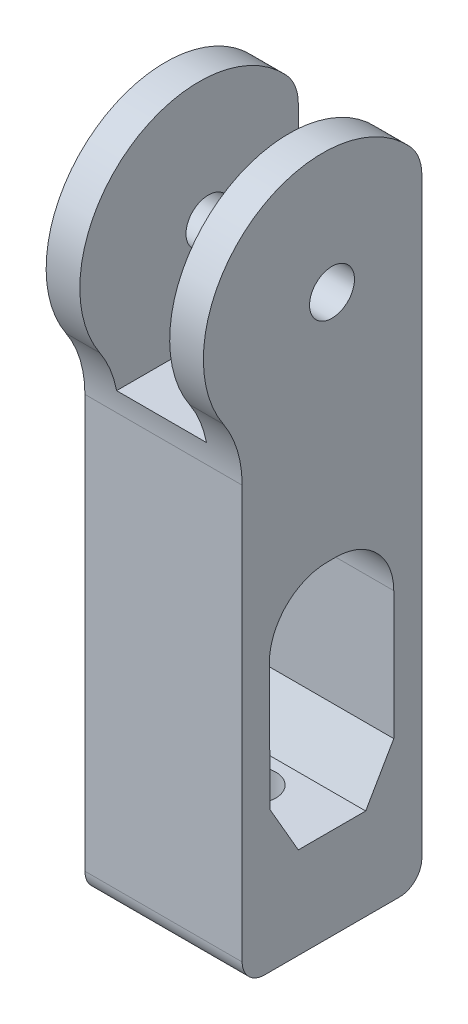
from build123d import *
from OCP.BRepFilletAPI import BRepFilletAPI_MakeChamfer

# Parameters (mm, degrees)
SKETCH9_R           = 2
BOSS_EXTRUDE3_DEPTH = 14
SKETCH10_R          = 2
CUT_EXTRUDE7_DEPTH  = 14
SKETCH11_W          = 8
SKETCH11_H          = 26.663957413
CUT_EXTRUDE8_DEPTH  = 25
FILLET1_R           = 2
CHAMFER1_SIZE       = 2.5
CHAMFER1_SIZE2      = 4.365846821
CHAMFER1_SIZE2_2    = 4.330127019


with BuildPart() as part:
    # Sketch9 → Boss-Extrude3 (new body)
    with BuildSketch(Plane(origin=(0, 0, 0), x_dir=(0, 0, -1), z_dir=(1, 0, 0))):
        with BuildLine():
            Line((8, 5.053889445), (8, -49.642014822))
            Line((8, -49.642014822), (-8, -49.642014822))
            Line((-8, -49.642014822), (-8, -10.875806049))
            ThreePointArc((-8, -10.875806049), (-8.427714838, -7.982476346), (-9.674271354, -5.336650652))
            ThreePointArc((-9.674271354, -5.336650652), (-7.418447874, 8.870328147), (6.925281884, 7.78202542))
            ThreePointArc((6.925281884, 7.78202542), (7.721634556, 6.519985019), (8, 5.053889445))
        make_face()
        Circle(SKETCH9_R, mode=Mode.SUBTRACT)
        with BuildLine():
            Line((5.5, -41.5), (5.5, -25.762364524))
            ThreePointArc((5.5, -25.762364524), (3.987567872, -22.111030369), (0.336233717, -20.598598241))
            Line((0.336233717, -20.598598241), (-0.410415455, -20.598598241))
            ThreePointArc((-0.410415455, -20.598598241), (-4.070351606, -22.119652678), (-5.574124284, -25.786723302))
            Line((-5.574124284, -25.786723302), (-5.5, -41.5))
            Line((-5.5, -41.5), (5.5, -41.5))
        make_face(mode=Mode.SUBTRACT)
    extrude(amount=BOSS_EXTRUDE3_DEPTH)

    # Sketch10 → Cut-Extrude7 (cut)
    with BuildSketch(Plane.XZ.offset(49.642014822)):
        with Locations(Location((7, 0, 0), (0, 0, 270))):
            Circle(SKETCH10_R)
    extrude(amount=-CUT_EXTRUDE7_DEPTH, mode=Mode.SUBTRACT)

    # Sketch11 → Cut-Extrude8 (cut)
    with BuildSketch(Plane(origin=(0, 16, 0), x_dir=(1, 0, 0), z_dir=(0, 1, 0))):
        with Locations((7, -2.726740944)):
            Rectangle(SKETCH11_W, SKETCH11_H)
    extrude(amount=-CUT_EXTRUDE8_DEPTH, mode=Mode.SUBTRACT)

    # Fillet1
    fillet1_edges = [part.edges().sort_by_distance(p)[0] for p in [
        (7, -49.642014822, 8),
        (7, -49.642014822, -8),
    ]]
    fillet(fillet1_edges, radius=FILLET1_R)

    # Chamfer1: one chamfer whose edges measure the first distance from different faces: ONE call of the kernel's chamfer builder (chamfer() names one face for all edges)
    chamfer1_edges_1 = [part.edges().sort_by_distance(p)[0] for p in [
        (7, -41.5, 5.5),
    ]]
    chamfer1_side_1 = [part.faces().sort_by_distance(p)[0] for p in [
        (7, -41.5, 5.321955062),
    ]]
    chamfer1_edges_2 = [part.edges().sort_by_distance(p)[0] for p in [
        (7, -41.5, -5.5),
    ]]
    chamfer1_side_2 = [part.faces().sort_by_distance(p)[0] for p in [
        (7, -41.5, 5.321955062),
    ]]
    chamfer1 = BRepFilletAPI_MakeChamfer(part.part.solid().wrapped)
    for e in chamfer1_edges_1:
        chamfer1.Add(CHAMFER1_SIZE, CHAMFER1_SIZE2, e.wrapped, chamfer1_side_1[0].wrapped)  # the first distance lies on this face
    for e in chamfer1_edges_2:
        chamfer1.Add(CHAMFER1_SIZE, CHAMFER1_SIZE2_2, e.wrapped, chamfer1_side_2[0].wrapped)  # the first distance lies on this face
    add(Compound.cast(chamfer1.Shape()), mode=Mode.REPLACE)


solid = part.part
